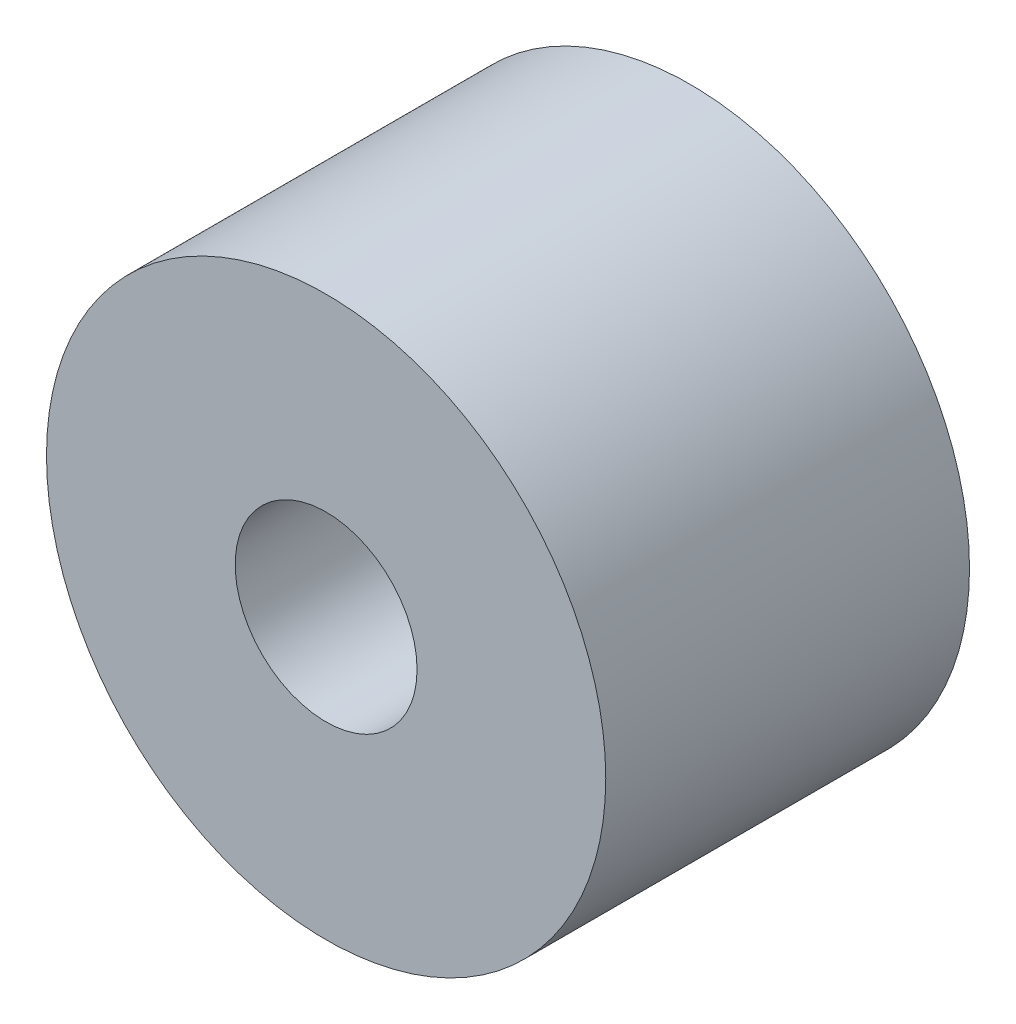
from build123d import *

# Parameters (mm, degrees)
SKETCH1_R           = 6.15
BOSS_EXTRUDE1_DEPTH = 8
SKETCH2_R           = 2
CUT_EXTRUDE1_DEPTH  = 12.817148556


with BuildPart() as part:
    # Sketch1 → Boss-Extrude1 (new body)
    with BuildSketch(Plane.XY):
        Circle(SKETCH1_R)
    extrude(amount=BOSS_EXTRUDE1_DEPTH)

    # Sketch2 → Cut-Extrude1 (cut, through all)
    with BuildSketch(Plane.XY.offset(8)):
        Circle(SKETCH2_R)
    extrude(amount=-CUT_EXTRUDE1_DEPTH, mode=Mode.SUBTRACT)


solid = part.part
